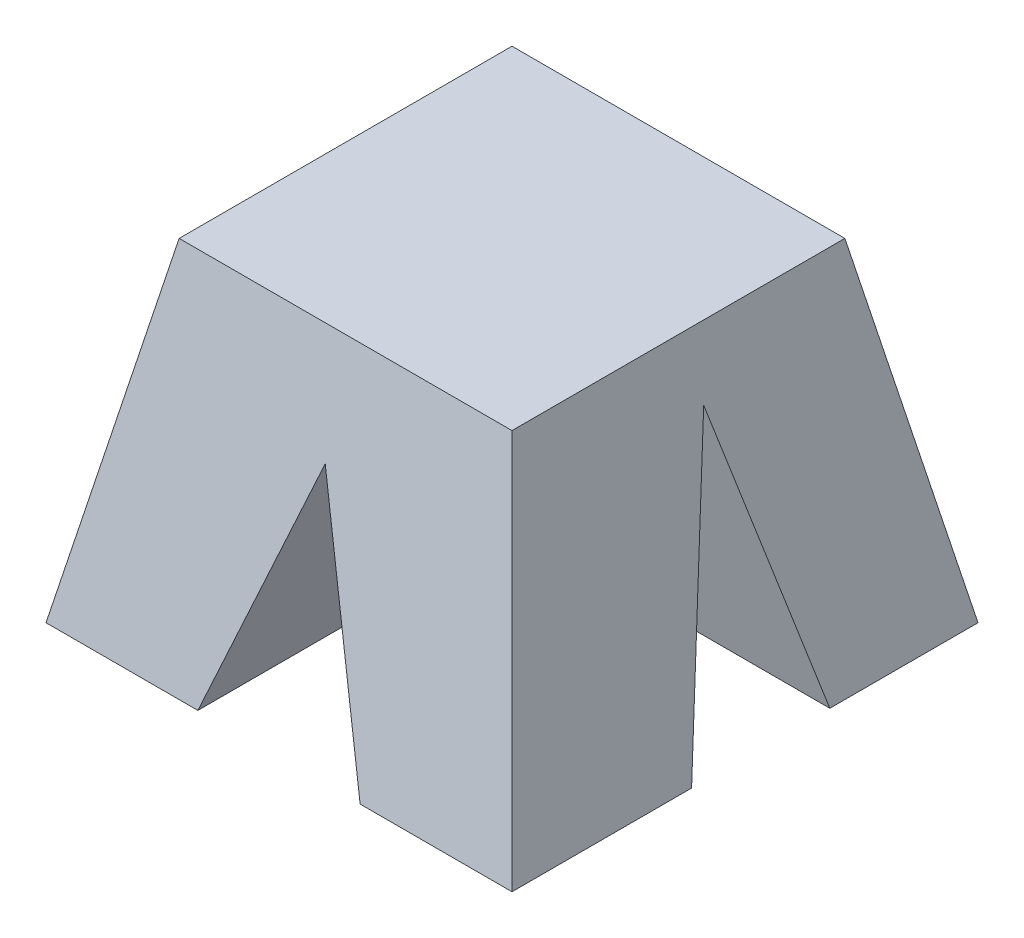
from build123d import *

# Parameters (mm, degrees)
CUT_EXTRUDE1_REACH = 8.403
CUT_EXTRUDE2_START = -3.4
CUT_EXTRUDE2_DEPTH = 2.8


with BuildPart() as part:
    # Sketch2 → Loft1 section 0
    with BuildSketch(Plane.XZ.offset(3)):
        with BuildLine():
            Line((-1, 2), (1, 2))
            Line((1, 2), (1, 0))
            Line((1, 0), (-1, 0))
            Line((-1, 0), (-1, 2))
        make_face()
    # Sketch3 → Loft1 section 1
    with BuildSketch(Plane(origin=(0, -5, 0), x_dir=(-1, 0, 0), z_dir=(0, -1, 0))):
        with BuildLine():
            Line((-1.4, 0.4), (1.4, 0.4))
            Line((1.4, 0.4), (1.4, -2.4))
            Line((1.4, -2.4), (-1.4, -2.4))
            Line((-1.4, -2.4), (-1.4, 0.4))
        make_face()
    loft()

    # Cut-Extrude1: up to this plane
    cut_extrude1_end = Plane(origin=(-0.384615385, 0.076923077, 0), z_dir=(0.9805806756909202, -0.19611613513818404, 0))
    # Sketch7 → Cut-Extrude1 (cut, up to the surface)
    with BuildSketch(Plane(origin=(1.8, 0, 0), x_dir=(0, 0, -1), z_dir=(1, 0, 0)), mode=Mode.PRIVATE) as cut_extrude1_sk1:
        Polygon((-0.395154694, -5.358903747), (-0.922322496, -3.37054148), (-1.444019859, -5.50302185), align=None)
    cut_extrude1_tool1 = split(extrude(cut_extrude1_sk1.sketch, amount=-CUT_EXTRUDE1_REACH, mode=Mode.PRIVATE), bisect_by=cut_extrude1_end, keep=Keep.BOTH, mode=Mode.PRIVATE)
    add(cut_extrude1_tool1.solids().sort_by_distance((1.8, -4.744156, 0.920499))[0], mode=Mode.SUBTRACT)

    # Sketch4 → Cut-Extrude2 (cut)
    with BuildSketch(Plane.XY.offset(3).offset(CUT_EXTRUDE2_START)):
        Polygon((0, -3.611513086), (-0.5, -5.035852242), (0.5, -5.035852242), align=None)
    extrude(amount=CUT_EXTRUDE2_DEPTH, mode=Mode.SUBTRACT)


solid = part.part
